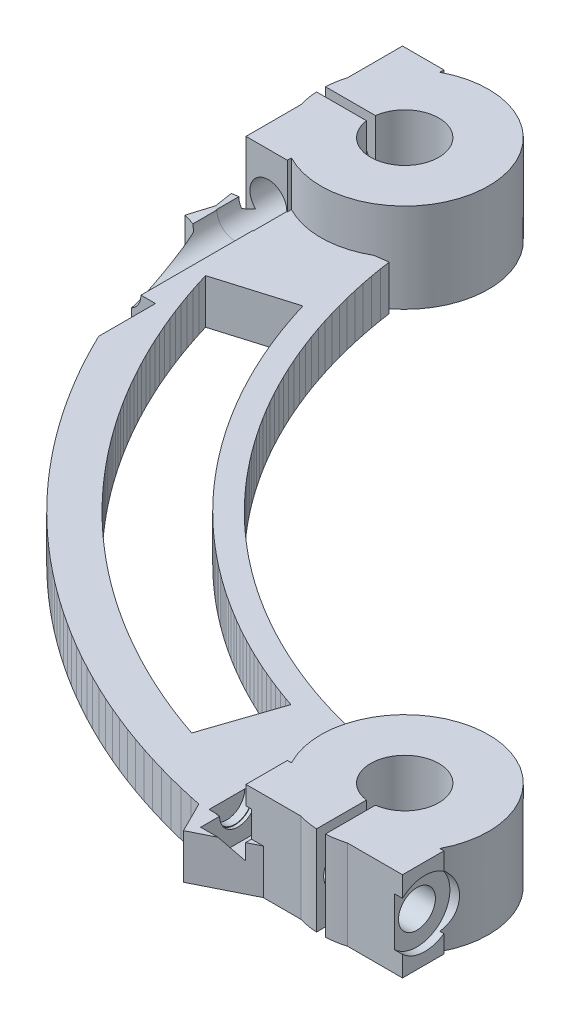
from build123d import *

# Parameters (mm, degrees)
MAIN_EXTRUSION_DEPTH        = 4
DETAIL_EXTRUSION_2_DEPTH    = 4
STOP_CLAMP_BORE_1_PROFILE_R = 1.65
STOP_CLAMP_BORE_1_DEPTH     = 20
STOP_CLAMP_BORE_2_PROFILE_R = 1.65
STOP_CLAMP_BORE_2_DEPTH     = 20
STOP_CLAMP_BORE_3_PROFILE_R = 1.6
STOP_CLAMP_BORE_3_DEPTH     = 40
STOP_CLAMP_BORE_4_PROFILE_R = 2.9
STOP_CLAMP_BORE_4_DEPTH     = 15
STOP_CLAMP_BORE_5_PROFILE_R = 1.6
STOP_CLAMP_BORE_5_DEPTH     = 23
STOP_CLAMP_BORE_6_PROFILE_R = 2.95
STOP_CLAMP_BORE_6_DEPTH     = 6
CAPTURED_NUT_POCKET_DEPTH   = 3.2


with BuildPart() as part:
    # Main Profile Sketch → Main Extrusion (new body)
    with BuildSketch(Plane(origin=(0, -120, 0), x_dir=(-1, 0, 0), z_dir=(0, -1, 0))):
        with BuildLine():
            Line((49.291651246, -53.5), (49.291651246, -57.2))
            Line((49.291651246, -57.2), (54.191651246, -57.2))
            ThreePointArc((54.191651246, -57.2), (55.033308151, -57.393684647), (55.891651246, -57.489325737))
            Line((55.891651246, -57.489325737), (55.891651246, -53.023656727))
            ThreePointArc((55.891651246, -53.023656727), (53.24824419, -49.799566739), (56.291651246, -46.95))
            ThreePointArc((56.291651246, -46.95), (59.335058302, -49.799566739), (56.691651246, -53.023656727))
            Line((56.691651246, -53.023656727), (56.691651246, -57.489325737))
            ThreePointArc((56.691651246, -57.489325737), (57.549994341, -57.393684647), (58.391651246, -57.2))
            Line((58.391651246, -57.2), (61.747379336, -57.2))
            Line((61.747379336, -57.2), (66.502796864, -59.577708764))
            Line((66.502796864, -59.577708764), (67.877393096, -56.828516299))
            Line((67.877393096, -56.828516299), (68.746300222, -56.646992143))
            Line((68.746300222, -56.646992143), (69.929893806, -56.373738034))
            Line((69.929893806, -56.373738034), (71.107505206, -56.075756539))
            Line((71.107505206, -56.075756539), (72.278617883, -55.753178364))
            Line((72.278617883, -55.753178364), (73.442718149, -55.406145003))
            Line((73.442718149, -55.406145003), (74.599295389, -55.034808675))
            Line((74.599295389, -55.034808675), (75.747842292, -54.639332262))
            Line((75.747842292, -54.639332262), (76.887855066, -54.219889231))
            Line((76.887855066, -54.219889231), (78.018833664, -53.776663565))
            Line((78.018833664, -53.776663565), (79.140282002, -53.309849677))
            Line((79.140282002, -53.309849677), (80.251708176, -52.819652327))
            Line((80.251708176, -52.819652327), (81.352624677, -52.306286531))
            Line((81.352624677, -52.306286531), (82.442548606, -51.76997747))
            Line((82.442548606, -51.76997747), (83.521001888, -51.210960386))
            Line((83.521001888, -51.210960386), (84.587511476, -50.629480482))
            Line((84.587511476, -50.629480482), (85.641609565, -50.025792814))
            Line((85.641609565, -50.025792814), (86.682833792, -49.40016218))
            Line((86.682833792, -49.40016218), (87.710727442, -48.752863003))
            Line((87.710727442, -48.752863003), (88.724839647, -48.084179208))
            Line((88.724839647, -48.084179208), (89.724725584, -47.394404103))
            Line((89.724725584, -47.394404103), (90.709946669, -46.683840247))
            Line((90.709946669, -46.683840247), (91.680070752, -45.952799315))
            Line((91.680070752, -45.952799315), (92.634672305, -45.201601966))
            Line((92.634672305, -45.201601966), (93.573332608, -44.430577701))
            Line((93.573332608, -44.430577701), (94.495639933, -43.640064716))
            Line((94.495639933, -43.640064716), (95.401189726, -42.830409756))
            Line((95.401189726, -42.830409756), (96.289584783, -42.001967963))
            Line((96.289584783, -42.001967963), (97.160435424, -41.155102719))
            Line((97.160435424, -41.155102719), (98.013359666, -40.290185487))
            Line((98.013359666, -40.290185487), (98.847983387, -39.407595647))
            Line((98.847983387, -39.407595647), (99.663940495, -38.507720334))
            Line((99.663940495, -38.507720334), (100.460873083, -37.590954262))
            Line((100.460873083, -37.590954262), (101.238431591, -36.657699555))
            Line((101.238431591, -36.657699555), (101.996274955, -35.708365569))
            Line((101.996274955, -35.708365569), (102.734070761, -34.743368714))
            Line((102.734070761, -34.743368714), (103.451495387, -33.763132269))
            Line((103.451495387, -33.763132269), (104.148234146, -32.768086199))
            Line((104.148234146, -32.768086199), (104.823981427, -31.758666963))
            Line((104.823981427, -31.758666963), (105.478440823, -30.735317326))
            Line((105.478440823, -30.735317326), (106.111325268, -29.698486162))
            Line((106.111325268, -29.698486162), (106.722357157, -28.648628262))
            Line((106.722357157, -28.648628262), (107.311268472, -27.586204126))
            Line((107.311268472, -27.586204126), (107.877800897, -26.511679769))
            Line((107.877800897, -26.511679769), (108.421705931, -25.425526514))
            Line((108.421705931, -25.425526514), (108.942745001, -24.328220782))
            Line((108.942745001, -24.328220782), (109.440689561, -23.220243888))
            Line((109.440689561, -23.220243888), (109.915321196, -22.102081828))
            Line((109.915321196, -22.102081828), (110.366431716, -20.974225065))
            Line((110.366431716, -20.974225065), (110.793823252, -19.837168313))
            Line((110.793823252, -19.837168313), (111.197308333, -18.691410323))
            Line((111.197308333, -18.691410323), (111.576709978, -17.537453664))
            Line((111.576709978, -17.537453664), (111.931861769, -16.375804497))
            Line((111.931861769, -16.375804497), (112.262607925, -15.206972361))
            Line((112.262607925, -15.206972361), (112.56880337, -14.031469945))
            Line((112.56880337, -14.031469945), (112.850313796, -12.849812862))
            Line((112.850313796, -12.849812862), (112.997874883, -12.167315804))
            Line((112.997874883, -12.167315804), (114.114767281, -11.823656605))
            Line((114.114767281, -11.823656605), (113.468048599, -9.721820889))
            Line((113.468048599, -9.721820889), (113.54555462, -9.273108886))
            Line((113.54555462, -9.273108886), (113.727199233, -8.072039856))
            Line((113.727199233, -8.072039856), (112.925767067, -7.95940591))
            Line((112.925767067, -7.95940591), (112.630565249, -7))
            Line((112.630565249, -7), (113.491651246, -7))
            Line((113.491651246, -7), (113.491651246, -2.1))
            ThreePointArc((113.491651246, -2.1), (113.685335893, -1.258343095), (113.780976983, -0.4))
            Line((113.780976983, -0.4), (109.264864995, -0.4))
            ThreePointArc((109.264864995, -0.4), (106.538522782, -2.989825153), (103.42431422, -0.882257547))
            Line((103.42431422, -0.882257547), (103.376525269, -0.896961839))
            ThreePointArc((103.376525269, -0.896961839), (105.394689407, 2.915125977), (109.206777223, 0.896961839))
            Line((109.206777223, 0.896961839), (109.158988272, 0.882257546))
            ThreePointArc((109.158988272, 0.882257546), (109.221864792, 0.643310636), (109.264864995, 0.4))
            Line((109.264864995, 0.4), (113.780976983, 0.4))
            ThreePointArc((113.780976983, 0.4), (113.685335893, 1.258343095), (113.491651246, 2.1))
            Line((113.491651246, 2.1), (113.491651246, 7))
            Line((113.491651246, 7), (109.791651246, 7))
            Line((109.791651246, 7), (109.791651246, 6.633249581))
            ThreePointArc((109.791651246, 6.633249581), (99.723155258, 3.620063598), (102.552721618, -6.501569444))
            Line((102.552721618, -6.501569444), (101.348848374, -6.332376094))
            Line((101.348848374, -6.332376094), (101.206351307, -7.27459404))
            Line((101.206351307, -7.27459404), (101.044153168, -8.213621109))
            Line((101.044153168, -8.213621109), (100.862325103, -9.149045412))
            Line((100.862325103, -9.149045412), (100.660946867, -10.080456642))
            Line((100.660946867, -10.080456642), (100.440106792, -11.00744625))
            Line((100.440106792, -11.00744625), (100.199901744, -11.929607628))
            Line((100.199901744, -11.929607628), (99.940437088, -12.846536286))
            Line((99.940437088, -12.846536286), (99.661826631, -13.757830029))
            Line((99.661826631, -13.757830029), (99.364192581, -14.663089133))
            Line((99.364192581, -14.663089133), (99.047665492, -15.561916521))
            Line((99.047665492, -15.561916521), (98.712384201, -16.453917939))
            Line((98.712384201, -16.453917939), (98.358495775, -17.338702124))
            Line((98.358495775, -17.338702124), (97.986155441, -18.215880981))
            Line((97.986155441, -18.215880981), (97.595526519, -19.085069751))
            Line((97.595526519, -19.085069751), (97.186780353, -19.945887179))
            Line((97.186780353, -19.945887179), (96.760096231, -20.797955681))
            Line((96.760096231, -20.797955681), (96.315661311, -21.640901513))
            Line((96.315661311, -21.640901513), (95.853670538, -22.47435493))
            Line((95.853670538, -22.47435493), (95.374326556, -23.297950352))
            Line((95.374326556, -23.297950352), (94.877839621, -24.111326523))
            Line((94.877839621, -24.111326523), (94.364427508, -24.914126669))
            Line((94.364427508, -24.914126669), (93.834315418, -25.705998656))
            Line((93.834315418, -25.705998656), (93.287735874, -26.486595142))
            Line((93.287735874, -26.486595142), (92.724928624, -27.255573732))
            Line((92.724928624, -27.255573732), (92.146140535, -28.012597127))
            Line((92.146140535, -28.012597127), (91.551625482, -28.757333271))
            Line((91.551625482, -28.757333271), (90.941644239, -29.489455498))
            Line((90.941644239, -29.489455498), (90.316464364, -30.208642676))
            Line((90.316464364, -30.208642676), (89.676360081, -30.914579344))
            Line((89.676360081, -30.914579344), (89.021612161, -31.606955856))
            Line((89.021612161, -31.606955856), (88.352507799, -32.285468512))
            Line((88.352507799, -32.285468512), (87.669340486, -32.949819695))
            Line((87.669340486, -32.949819695), (86.972409881, -33.599717998))
            Line((86.972409881, -33.599717998), (86.262021681, -34.234878355))
            Line((86.262021681, -34.234878355), (85.538487487, -34.855022162))
            Line((85.538487487, -34.855022162), (84.802124663, -35.459877404))
            Line((84.802124663, -35.459877404), (84.053256203, -36.049178773))
            Line((84.053256203, -36.049178773), (83.292210586, -36.62266778))
            Line((83.292210586, -36.62266778), (82.519321632, -37.180092874))
            Line((82.519321632, -37.180092874), (81.734928354, -37.721209551))
            Line((81.734928354, -37.721209551), (80.939374814, -38.245780459))
            Line((80.939374814, -38.245780459), (80.133009968, -38.753575504))
            Line((80.133009968, -38.753575504), (79.316187513, -39.244371949))
            Line((79.316187513, -39.244371949), (78.489265737, -39.717954516))
            Line((78.489265737, -39.717954516), (77.652607353, -40.174115475))
            Line((77.652607353, -40.174115475), (76.806579347, -40.61265474))
            Line((76.806579347, -40.61265474), (75.951552816, -41.033379951))
            Line((75.951552816, -41.033379951), (75.087902803, -41.436106567))
            Line((75.087902803, -41.436106567), (74.216008132, -41.820657936))
            Line((74.216008132, -41.820657936), (73.336251246, -42.186865383))
            Line((73.336251246, -42.186865383), (72.449018036, -42.534568276))
            Line((72.449018036, -42.534568276), (71.55469767, -42.863614102))
            Line((71.55469767, -42.863614102), (70.653682427, -43.17385853))
            Line((70.653682427, -43.17385853), (69.746367523, -43.465165477))
            Line((69.746367523, -43.465165477), (68.833150936, -43.737407165))
            Line((68.833150936, -43.737407165), (67.914433232, -43.990464182))
            Line((67.914433232, -43.990464182), (66.990617392, -44.224225526))
            Line((66.990617392, -44.224225526), (66.062108632, -44.438588664))
            Line((66.062108632, -44.438588664), (65.129314226, -44.633459568))
            Line((65.129314226, -44.633459568), (64.19264333, -44.808752762))
            Line((64.19264333, -44.808752762), (65.095631697, -49.92985427))
            Line((65.095631697, -49.92985427), (63.755010012, -49.259543428))
            ThreePointArc((63.755010012, -49.259543428), (54.131179469, -42.817913834), (49.658401665, -53.5))
            Line((49.658401665, -53.5), (49.291651246, -53.5))
        make_face()
        Polygon((100.847886322, -16.461832094), (101.104373107, -15.750236805), (101.349496015, -15.034647477), (101.583192886, -14.315245574), (101.805404458, -13.592213525), (108.512694405, -15.595276571), (108.257735865, -16.424860711), (107.989599455, -17.250279737), (107.708353171, -18.071324334), (107.414068333, -18.887786297), (107.106819567, -19.699458583), (106.786684789, -20.506135362), (106.453745179, -21.307612074), (106.108085166, -22.103685474), (105.749792404, -22.89415369), (105.378957753, -23.678816269), (104.995675249, -24.457474234), (104.600042089, -25.229930126), (104.192158599, -25.995988062), (103.772128213, -26.755453781), (103.340057444, -27.508134692), (102.89605586, -28.253839926), (102.440236053, -28.992380383), (101.972713613, -29.723568779), (101.493607097, -30.447219696), (101.003038, -31.163149625), (100.501130722, -31.871177017), (99.988012541, -32.571122326), (99.463813577, -33.262808055), (98.928666757, -33.946058803), (98.38270779, -34.620701308), (97.826075121, -35.286564488), (97.258909906, -35.943479491), (96.681355968, -36.591279732), (96.093559769, -37.229800939), (95.495670364, -37.85888119), (94.887839371, -38.478360961), (94.270220926, -39.088083159), (93.642971649, -39.687893169), (93.006250601, -40.277638885), (92.360219247, -40.857170758), (91.70504141, -41.426341826), (91.040883234, -41.985007756), (90.367913141, -42.533026876), (89.686301786, -43.070260219), (88.996222017, -43.596571547), (88.297848827, -44.111827398), (87.591359316, -44.615897108), (86.876932637, -45.108652853), (86.154749961, -45.589969677), (85.424994422, -46.059725524), (84.687851076, -46.517801272), (83.943506853, -46.964080758), (83.192150507, -47.398450813), (82.433972572, -47.820801286), (81.669165312, -48.231025076), (80.89792267, -48.629018154), (80.120440223, -49.014679596), (79.33691513, -49.387911603), (78.547546081, -49.748619529), (77.75253325, -50.096711904), (76.952078241, -50.432100456), (76.146384037, -50.754700135), (75.335654952, -51.064429135), (74.520096575, -51.361208912), (73.69991572, -51.644964208), (71.463991842, -45.011666053), (72.178828367, -44.764356391), (72.889636127, -44.505695117), (73.596234871, -44.235747824), (74.298445416, -43.954582966), (74.99608969, -43.662271843), (75.688990782, -43.358888581), (76.37697298, -43.044510113), (77.059861823, -42.719216161), (77.737484139, -42.383089217), (78.409668092, -42.036214515), (79.076243228, -41.67868002), (79.73704051, -41.310576397), (80.391892371, -40.931996991), (81.04063275, -40.543037806), (81.683097133, -40.143797475), (82.319122603, -39.734377241), (82.948547872, -39.314880927), (83.571213325, -38.885414911), (84.186961065, -38.446088099), (84.795634945, -37.997011899), (85.397080616, -37.538300191), (85.991145558, -37.070069296), (86.577679125, -36.592437952), (87.156532581, -36.10552728), (87.727559137, -35.609460753), (88.290613987, -35.104364166), (88.845554349, -34.590365606), (89.392239499, -34.067595414), (89.930530804, -33.536186158), (90.460291762, -32.996272597), (90.981388032, -32.447991644), (91.493687472, -31.891482335), (91.997060169, -31.326885795), (92.491378477, -30.754345196), (92.976517041, -30.174005727), (93.452352839, -29.586014553), (93.918765204, -28.990520782), (94.375635861, -28.387675421), (94.822848955, -27.777631345), (95.260291077, -27.160543251), (95.6878513, -26.536567625), (96.105421199, -25.905862698), (96.512894886, -25.268588407), (96.910169029, -24.624906357), (97.297142887, -23.974979777), (97.673718327, -23.318973479), (98.039799856, -22.657053816), (98.395294641, -21.989388642), (98.740112533, -21.316147268), (99.074166091, -20.637500418), (99.397370604, -19.953620188), (99.709644112, -19.26468), (100.010907426, -18.57085456), (100.30108415, -17.872319811), (100.5801007, -17.169252893), align=None, mode=Mode.SUBTRACT)
    extrude(amount=-MAIN_EXTRUSION_DEPTH)

    # Detail Profile 2 Sketch → Detail Extrusion 2 (add)
    with BuildSketch(Plane(origin=(0, -116, 0), x_dir=(-1, 0, 0), z_dir=(0, -1, 0))):
        with BuildLine():
            Line((49.291651246, -53.5), (49.291651246, -57.2))
            Line((49.291651246, -57.2), (54.191651246, -57.2))
            ThreePointArc((54.191651246, -57.2), (55.033308151, -57.393684647), (55.891651246, -57.489325737))
            Line((55.891651246, -57.489325737), (55.891651246, -53.023656727))
            ThreePointArc((55.891651246, -53.023656727), (53.24824419, -49.799566739), (56.291651246, -46.95))
            ThreePointArc((56.291651246, -46.95), (59.335058302, -49.799566739), (56.691651246, -53.023656727))
            Line((56.691651246, -53.023656727), (56.691651246, -57.489325737))
            ThreePointArc((56.691651246, -57.489325737), (57.549994341, -57.393684647), (58.391651246, -57.2))
            Line((58.391651246, -57.2), (63.291651246, -57.2))
            Line((63.291651246, -57.2), (63.291651246, -53.5))
            Line((63.291651246, -53.5), (62.924900827, -53.5))
            ThreePointArc((62.924900827, -53.5), (56.291651246, -42.5), (49.658401665, -53.5))
            Line((49.658401665, -53.5), (49.291651246, -53.5))
        make_face()
        with BuildLine():
            Line((109.791651246, -7), (113.491651246, -7))
            Line((113.491651246, -7), (113.491651246, -2.1))
            ThreePointArc((113.491651246, -2.1), (113.685335893, -1.258343095), (113.780976983, -0.4))
            Line((113.780976983, -0.4), (109.315307973, -0.4))
            ThreePointArc((109.315307973, -0.4), (103.241651246, 0), (109.315307973, 0.4))
            Line((109.315307973, 0.4), (113.780976983, 0.4))
            ThreePointArc((113.780976983, 0.4), (113.685335893, 1.258343095), (113.491651246, 2.1))
            Line((113.491651246, 2.1), (113.491651246, 7))
            Line((113.491651246, 7), (109.791651246, 7))
            Line((109.791651246, 7), (109.791651246, 6.633249581))
            ThreePointArc((109.791651246, 6.633249581), (98.791651246, 0), (109.791651246, -6.633249581))
            Line((109.791651246, -6.633249581), (109.791651246, -7))
        make_face()
    extrude(amount=-DETAIL_EXTRUSION_2_DEPTH)

    # Stop Clamp Bore 1 profile → Stop Clamp Bore 1 (cut)
    with BuildSketch(Plane.XY.offset(-10)):
        with Locations(Location((-111.491651246, -116, 0), (0, 0, 180))):
            Circle(STOP_CLAMP_BORE_1_PROFILE_R)
    extrude(amount=STOP_CLAMP_BORE_1_DEPTH, mode=Mode.SUBTRACT)

    # Stop Clamp Bore 2 profile → Stop Clamp Bore 2 (cut)
    with BuildSketch(Plane(origin=(-66.291651246, 0, 0), x_dir=(0, 0, -1), z_dir=(1, 0, 0))):
        with Locations((-55.2, -116)):
            Circle(STOP_CLAMP_BORE_2_PROFILE_R)
    extrude(amount=STOP_CLAMP_BORE_2_DEPTH, mode=Mode.SUBTRACT)

    # Stop Clamp Bore 3 profile → Stop Clamp Bore 3 (cut)
    with BuildSketch(Plane.XY.offset(-11)):
        with Locations((-111.491651246, -116)):
            Circle(STOP_CLAMP_BORE_3_PROFILE_R)
    extrude(amount=STOP_CLAMP_BORE_3_DEPTH, mode=Mode.SUBTRACT)

    # Stop Clamp Bore 4 profile → Stop Clamp Bore 4 (cut)
    with BuildSketch(Plane.XY.offset(20)):
        with Locations((-111.491651246, -116)):
            Circle(STOP_CLAMP_BORE_4_PROFILE_R)
    extrude(amount=STOP_CLAMP_BORE_4_DEPTH, mode=Mode.SUBTRACT)

    # Stop Clamp Bore 5 profile → Stop Clamp Bore 5 (cut)
    with BuildSketch(Plane(origin=(-67, 0, 0), x_dir=(0, 0, -1), z_dir=(1, 0, 0))):
        with Locations((-55.2, -116)):
            Circle(STOP_CLAMP_BORE_5_PROFILE_R)
    extrude(amount=STOP_CLAMP_BORE_5_DEPTH, mode=Mode.SUBTRACT)

    # Stop Clamp Bore 6 profile → Stop Clamp Bore 6 (cut)
    with BuildSketch(Plane(origin=(-50, 0, 0), x_dir=(0, 0, -1), z_dir=(1, 0, 0))):
        with Locations((-55.2, -116)):
            Circle(STOP_CLAMP_BORE_6_PROFILE_R)
    extrude(amount=STOP_CLAMP_BORE_6_DEPTH, mode=Mode.SUBTRACT)

    # Captured Nut Sketch → Captured Nut Pocket (cut)
    with BuildSketch(Plane(origin=(-66, 0, 0), x_dir=(0, 0, -1), z_dir=(1, 0, 0))):
        Polygon((-56.874315781, -113.1), (-58.548631561, -116), (-56.874315781, -118.9), (-53.525684219, -118.9), (-51.851368439, -116), (-53.525684219, -113.1), align=None)
    extrude(amount=CAPTURED_NUT_POCKET_DEPTH, mode=Mode.SUBTRACT)


solid = part.part
